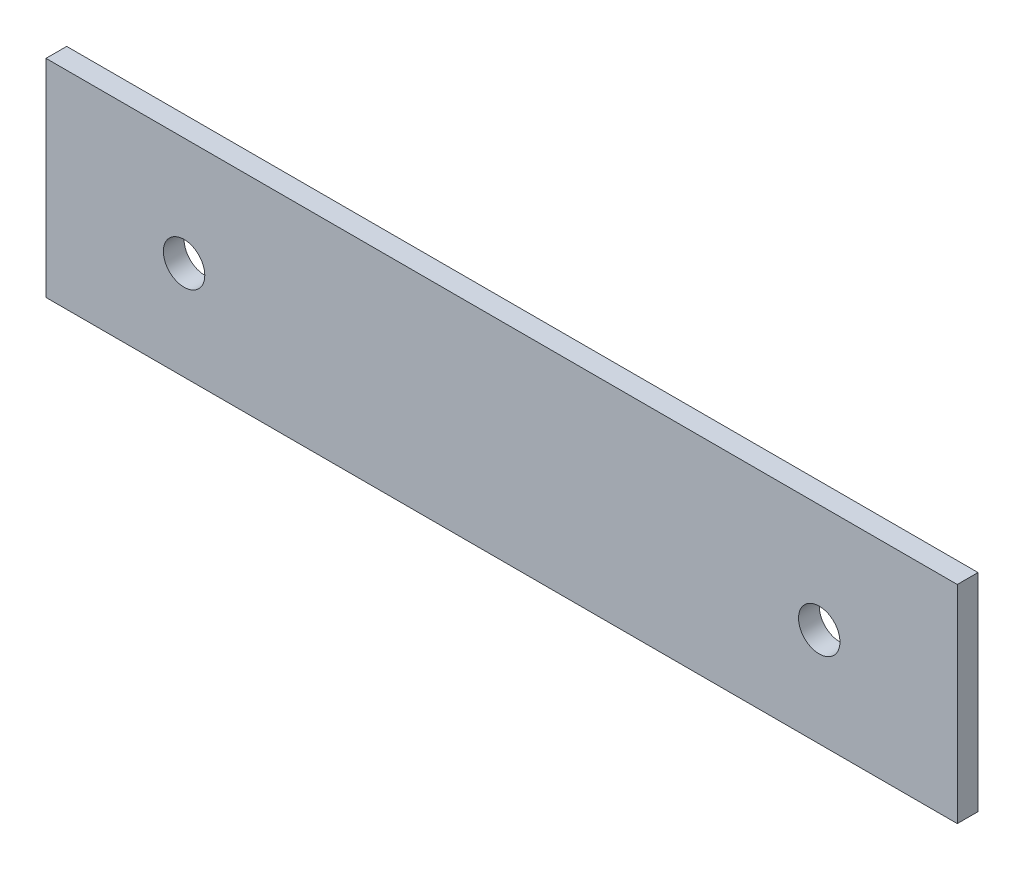
from build123d import *

# Parameters (mm, degrees)
ESQUISSE1_W      = 66
ESQUISSE1_H      = 15
ESQUISSE1_R      = 1.5
EXTRUSION1_DEPTH = 1.5


with BuildPart() as part:
    # Esquisse1 → Extrusion1 (new body)
    with BuildSketch(Plane.XY):
        with Locations((6.344552456, 12.262275132)):
            Rectangle(ESQUISSE1_W, ESQUISSE1_H)
        with Locations((-16.655447544, 11.904943045)):
            Circle(ESQUISSE1_R, mode=Mode.SUBTRACT)
        with Locations((29.344552456, 11.904943045)):
            Circle(ESQUISSE1_R, mode=Mode.SUBTRACT)
    extrude(amount=EXTRUSION1_DEPTH)


solid = part.part
